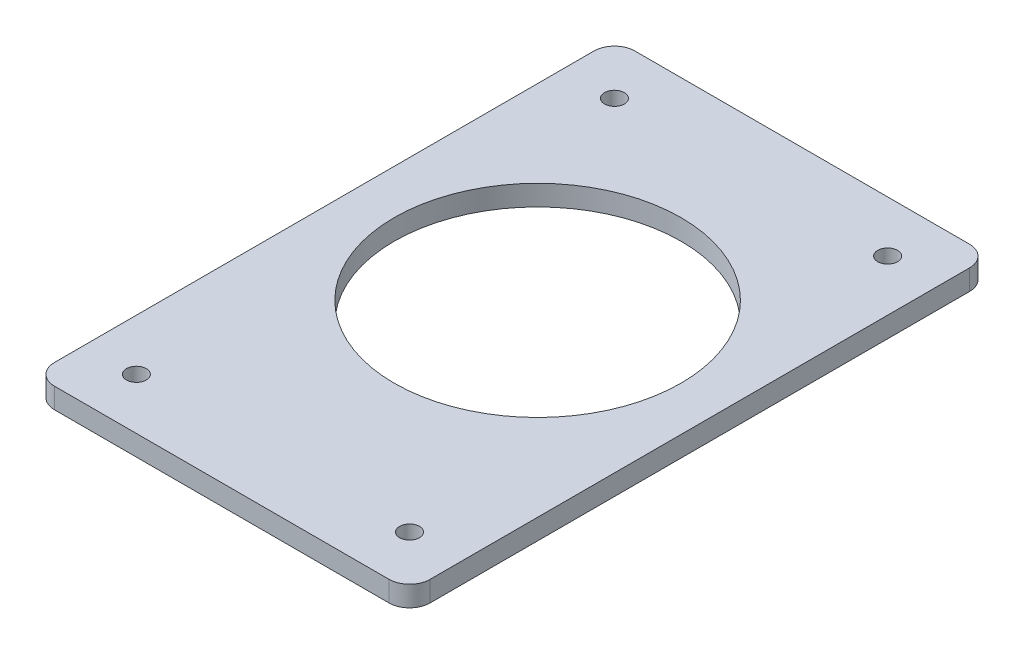
from build123d import *

# Parameters (mm, degrees)
SKETCH_1_W          = 55
SKETCH_1_H          = 85
SKETCH_1_R          = 21
EXTRUDE_1_DEPTH     = 3
SKETCH_2_R          = 1.45
CUT_EXTRUDE_1_DEPTH = 3
FILLET_1_R          = 3


with BuildPart() as part:
    # 草图1 → 凸台-拉伸1 (new body)
    with BuildSketch(Plane(origin=(0, 0, 0), x_dir=(1, 0, 0), z_dir=(0, 1, 0))):
        with Locations((0, -3.75)):
            Rectangle(SKETCH_1_W, SKETCH_1_H)
        with Locations(Location((0, 0, 0), (0, 0, 270))):
            Circle(SKETCH_1_R, mode=Mode.SUBTRACT)
    extrude(amount=EXTRUDE_1_DEPTH)

    # 草图2 → 切除-拉伸1 (cut)
    with BuildSketch(Plane(origin=(0, 3, 0), x_dir=(1, 0, 0), z_dir=(0, 1, 0))):
        with Locations(Location((-20, 31.25, 0), (0, 0, 270))):
            Circle(SKETCH_2_R)
        with Locations(Location((20, 31.25, 0), (0, 0, 270))):
            Circle(SKETCH_2_R)
        with Locations(Location((-20, -38.75, 0), (0, 0, 90))):
            Circle(SKETCH_2_R)
        with Locations(Location((20, -38.75, 0), (0, 0, 90))):
            Circle(SKETCH_2_R)
    extrude(amount=-CUT_EXTRUDE_1_DEPTH, mode=Mode.SUBTRACT)

    # 圆角1
    fillet_1_edges = [part.edges().sort_by_distance(p)[0] for p in [
        (27.5, 1.5, 46.25),
        (-27.5, 1.5, 46.25),
        (-27.5, 1.5, -38.75),
        (27.5, 1.5, -38.75),
    ]]
    fillet(fillet_1_edges, radius=FILLET_1_R)


solid = part.part
